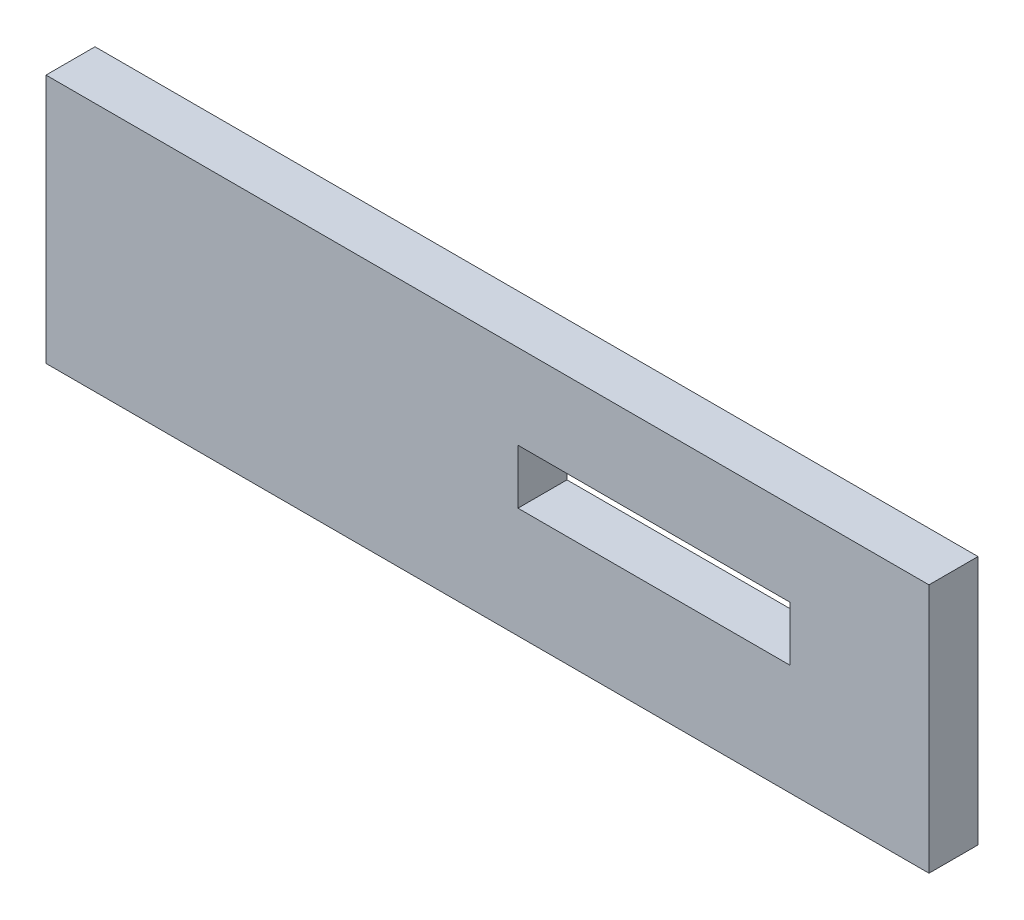
from build123d import *

# Parameters (mm, degrees)
SKETCH1_W           = 56.256588963
SKETCH1_H           = 16
SKETCH1_R           = 3.1
SKETCH1_W_2         = 17.2
SKETCH1_H_2         = 3.45
SKETCH1_W_3         = 16
SKETCH1_H_3         = 6.5
BOSS_EXTRUDE1_DEPTH = 3.100997352
SKETCH1_3_R         = 3.1
CUT_EXTRUDE1_DEPTH  = 3.05
SKETCH1_4_W         = 16
SKETCH1_4_H         = 6.5
CUT_EXTRUDE2_DEPTH  = 2.5
SKETCH2_W           = 56.256588963
SKETCH2_H           = 16
SKETCH2_W_2         = 55.856588963
SKETCH2_H_2         = 15.8
CUT_EXTRUDE3_DEPTH  = 3.100997352


with BuildPart() as part:
    # Sketch1 → Boss-Extrude1 (new body)
    # profile 1 of 4: a face of its own
    with BuildSketch(Plane.XY):
        with Locations((-177.370194481, -4)):
            Rectangle(SKETCH1_W, SKETCH1_H)
        with Locations((-153.2419, -5)):
            Circle(SKETCH1_R, mode=Mode.SUBTRACT)
        with Locations((-201.137394481, -5)):
            Circle(SKETCH1_R, mode=Mode.SUBTRACT)
        with Locations((-166.8419, -3.175)):
            Rectangle(SKETCH1_W_2, SKETCH1_H_2, mode=Mode.SUBTRACT)
        with Locations((-186.748488963, -2.799282455)):
            Rectangle(SKETCH1_W_3, SKETCH1_H_3, mode=Mode.SUBTRACT)
    # profile 2 of 4: a face of its own
    with BuildSketch(Plane.XY):
        with Locations((-153.2419, -5)):
            Circle(SKETCH1_R)
    # profile 3 of 4: a face of its own
    with BuildSketch(Plane.XY):
        with Locations((-201.137394481, -5)):
            Circle(SKETCH1_R)
    # profile 4 of 4: a face of its own
    with BuildSketch(Plane.XY):
        with Locations((-186.748488963, -2.799282455)):
            Rectangle(SKETCH1_W_3, SKETCH1_H_3)
    extrude(amount=BOSS_EXTRUDE1_DEPTH)

    # Sketch1<3> → Cut-Extrude1 (cut)
    with BuildSketch(Plane.XY):
        with Locations((-201.137394481, -5)):
            Circle(SKETCH1_3_R)
        with Locations((-153.2419, -5)):
            Circle(SKETCH1_3_R)
    extrude(amount=CUT_EXTRUDE1_DEPTH, mode=Mode.SUBTRACT)

    # Sketch1<4> → Cut-Extrude2 (cut)
    with BuildSketch(Plane.XY):
        with Locations((-186.748488963, -2.799282455)):
            Rectangle(SKETCH1_4_W, SKETCH1_4_H)
    extrude(amount=CUT_EXTRUDE2_DEPTH, mode=Mode.SUBTRACT)

    # Sketch2 → Cut-Extrude3 (cut)
    with BuildSketch(Plane.XY.offset(3.100997352)):
        with Locations((-177.370194481, -4)):
            Rectangle(SKETCH2_W, SKETCH2_H)
        with Locations((-177.370194481, -4)):
            Rectangle(SKETCH2_W_2, SKETCH2_H_2, mode=Mode.SUBTRACT)
    extrude(amount=-CUT_EXTRUDE3_DEPTH, mode=Mode.SUBTRACT)


solid = part.part
